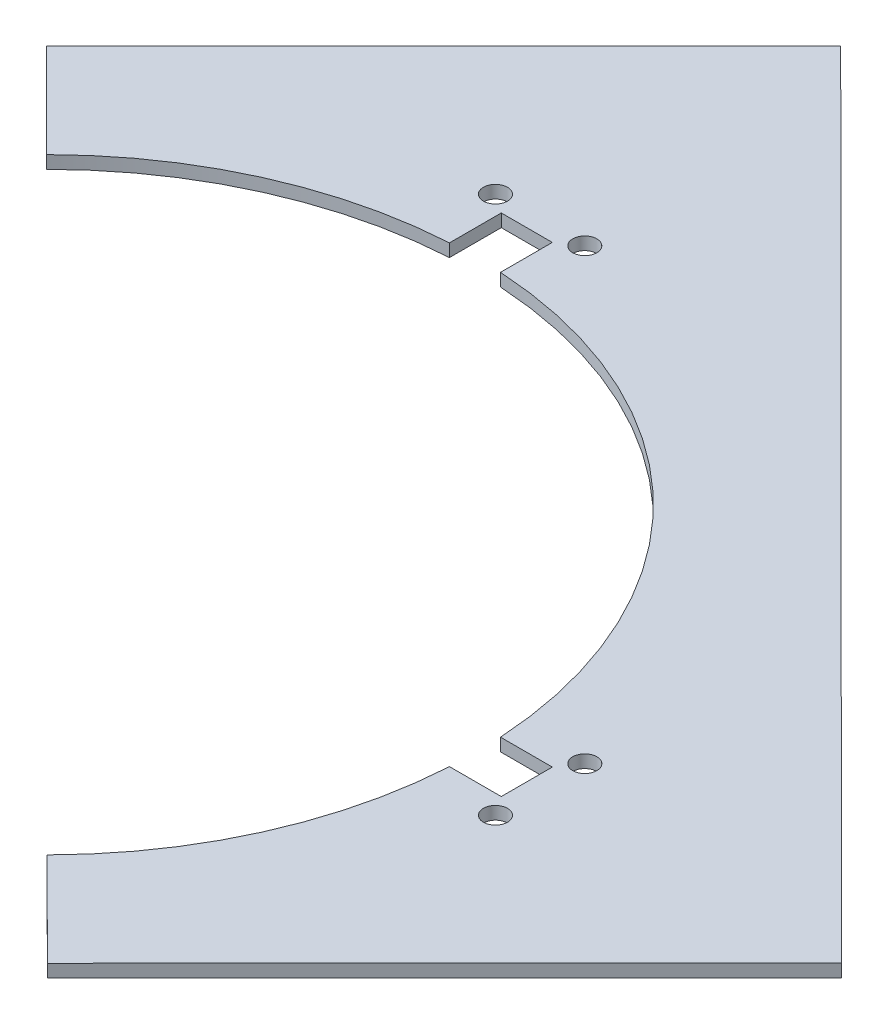
from build123d import *

# Parameters (mm, degrees)
SKETCH1_R           = 1.5
SKETCH1_R_2         = 53.34
BOSS_EXTRUDE1_DEPTH = 1.5875
CUT_EXTRUDE3_DEPTH  = 140.70900378
CUT_EXTRUDE4_DEPTH  = 140.70900378


with BuildPart() as part:
    # Sketch1 → Boss-Extrude1 (new body)
    with BuildSketch(Plane(origin=(0, 0, 0), x_dir=(1, 0, 0), z_dir=(0, 1, 0))):
        Polygon((0.047005036, -98.782806148), (-98.782806148, -0.047005036), (-0.047005036, 98.782806148), (98.782806148, 0.047005036), align=None)
        with Locations(Location((-61.346730494, 5.55625, 0), (0, 0, 270))):
            Circle(SKETCH1_R, mode=Mode.SUBTRACT)
        with Locations(Location((-61.346730494, -5.55625, 0), (0, 0, 270))):
            Circle(SKETCH1_R, mode=Mode.SUBTRACT)
        with Locations(Location((-5.55625, -61.346730494, 0), (0, 0, 270))):
            Circle(SKETCH1_R, mode=Mode.SUBTRACT)
        with Locations(Location((5.55625, -61.346730494, 0), (0, 0, 270))):
            Circle(SKETCH1_R, mode=Mode.SUBTRACT)
        with Locations(Location((61.346730494, -5.55625, 0), (0, 0, 270))):
            Circle(SKETCH1_R, mode=Mode.SUBTRACT)
        with Locations(Location((61.346730494, 5.55625, 0), (0, 0, 270))):
            Circle(SKETCH1_R, mode=Mode.SUBTRACT)
        with Locations(Location((5.55625, 61.346730494, 0), (0, 0, 270))):
            Circle(SKETCH1_R, mode=Mode.SUBTRACT)
        with Locations(Location((-5.55625, 61.346730494, 0), (0, 0, 270))):
            Circle(SKETCH1_R, mode=Mode.SUBTRACT)
        with Locations(Location((0, 0, 0), (0, 0, 270))):
            Circle(SKETCH1_R_2, mode=Mode.SUBTRACT)
    extrude(amount=BOSS_EXTRUDE1_DEPTH)

    # Sketch2 → Cut-Extrude3 (cut, through all)
    with BuildSketch(Plane(origin=(0, 1.5875, 0), x_dir=(1, 0, 0), z_dir=(0, 1, 0))):
        Polygon((3.175, 53.34), (3.175, 59.69), (-3.175, 59.69), (-3.175, 53.34), (-3.175, 52.244537665), (3.175, 52.244537665), align=None)
        Polygon((53.34, -3.175), (59.69, -3.175), (59.69, 3.175), (53.34, 3.175), (52.244537665, 3.175), (52.244537665, -3.175), align=None)
        Polygon((-3.175, -53.34), (-3.175, -59.69), (3.175, -59.69), (3.175, -53.34), (3.175, -52.244537665), (-3.175, -52.244537665), align=None)
        Polygon((-53.34, 3.175), (-59.69, 3.175), (-59.69, -3.175), (-53.34, -3.175), (-52.244537665, -3.175), (-52.244537665, 3.175), align=None)
    extrude(amount=-CUT_EXTRUDE3_DEPTH, mode=Mode.SUBTRACT)

    # Sketch3 → Cut-Extrude4 (cut, through all)
    with BuildSketch(Plane(origin=(0, 1.5875, 0), x_dir=(1, 0, 0), z_dir=(0, 1, 0))):
        Polygon((-49.414905592, 49.367900556), (49.414905592, -49.367900556), (0.047005036, -98.782806148), (-98.782806148, -0.047005036), align=None)
    extrude(amount=-CUT_EXTRUDE4_DEPTH, mode=Mode.SUBTRACT)


solid = part.part
